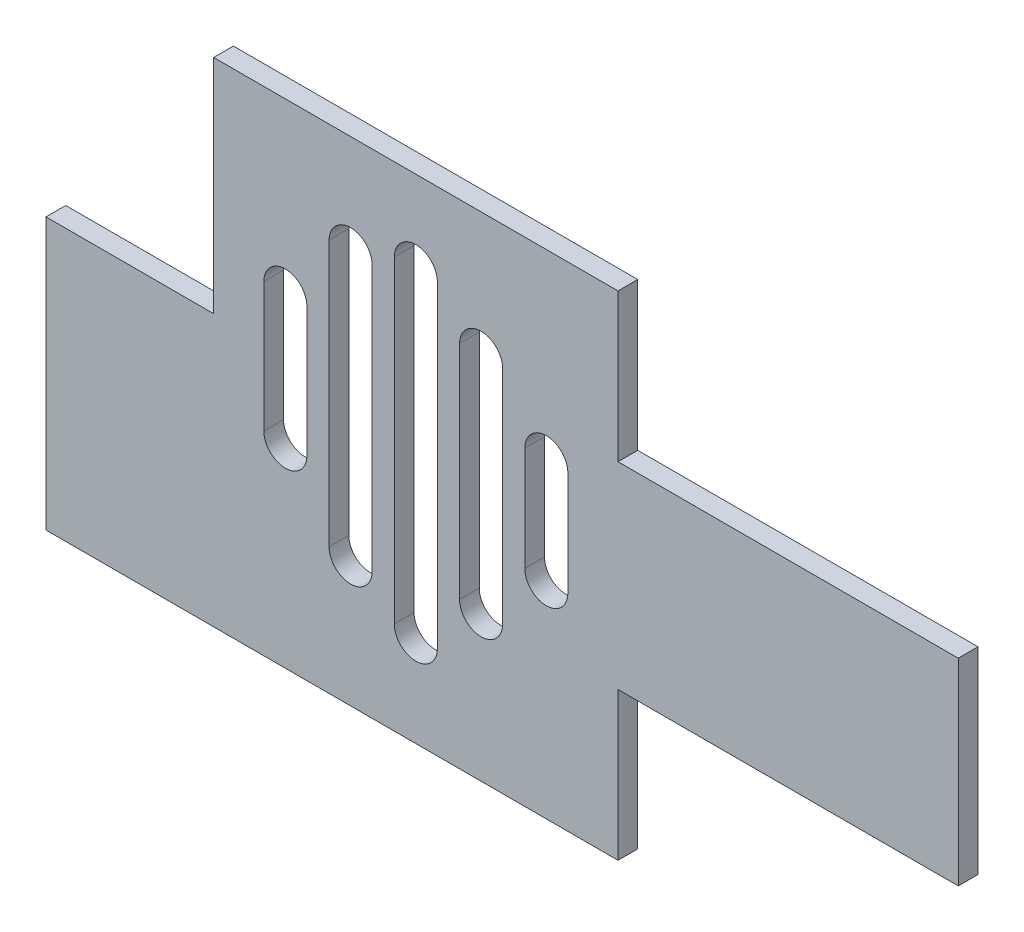
from build123d import *

# Parameters (mm, degrees)
BOSS_EXTRUDE1_DEPTH = 4


with BuildPart() as part:
    # Sketch1 → Boss-Extrude1 (new body)
    with BuildSketch(Plane.XY):
        Polygon((-41, 50), (-41, 5), (-75, 5), (-75, -50), (41, -50), (41, -20), (110, -20), (110, 20), (41, 20), (41, 50), align=None)
        with BuildLine():
            Line((4.364841143, 33.268336331), (4.364841143, -31.161160072))
            ThreePointArc((4.364841143, -31.161160072), (0, -35.526001215), (-4.364841143, -31.161160072))
            Line((-4.364841143, -31.161160072), (-4.364841143, 33.268336331))
            ThreePointArc((-4.364841143, 33.268336331), (0, 37.633177474), (4.364841143, 33.268336331))
        make_face(mode=Mode.SUBTRACT)
        with BuildLine():
            Line((-8.864841143, 29.633851918), (-8.864841143, -24.222598921))
            ThreePointArc((-8.864841143, -24.222598921), (-13.229682283, -28.587440061), (-17.594523423, -24.222598921))
            Line((-17.594523423, -24.222598921), (-17.594523423, 29.633851918))
            ThreePointArc((-17.594523423, 29.633851918), (-13.229682283, 33.998693058), (-8.864841143, 29.633851918))
        make_face(mode=Mode.SUBTRACT)
        with BuildLine():
            Line((17.594523423, 24.677736811), (17.594523423, -20.257706835))
            ThreePointArc((17.594523423, -20.257706835), (13.229682283, -24.622547975), (8.864841143, -20.257706835))
            Line((8.864841143, -20.257706835), (8.864841143, 24.677736811))
            ThreePointArc((8.864841143, 24.677736811), (13.229682283, 29.042577951), (17.594523423, 24.677736811))
        make_face(mode=Mode.SUBTRACT)
        with BuildLine():
            Line((-22.094523423, 15.756729616), (-22.094523423, -10.510680456))
            ThreePointArc((-22.094523423, -10.510680456), (-26.459364563, -14.875521596), (-30.824205703, -10.510680456))
            Line((-30.824205703, -10.510680456), (-30.824205703, 15.756729616))
            ThreePointArc((-30.824205703, 15.756729616), (-26.459364563, 20.121570756), (-22.094523423, 15.756729616))
        make_face(mode=Mode.SUBTRACT)
        with BuildLine():
            Line((30.824205703, 12.948264388), (30.824205703, -8.197826739))
            ThreePointArc((30.824205703, -8.197826739), (26.459364563, -12.562667879), (22.094523423, -8.197826739))
            Line((22.094523423, -8.197826739), (22.094523423, 12.948264388))
            ThreePointArc((22.094523423, 12.948264388), (26.459364563, 17.313105528), (30.824205703, 12.948264388))
        make_face(mode=Mode.SUBTRACT)
    extrude(amount=BOSS_EXTRUDE1_DEPTH)


solid = part.part
